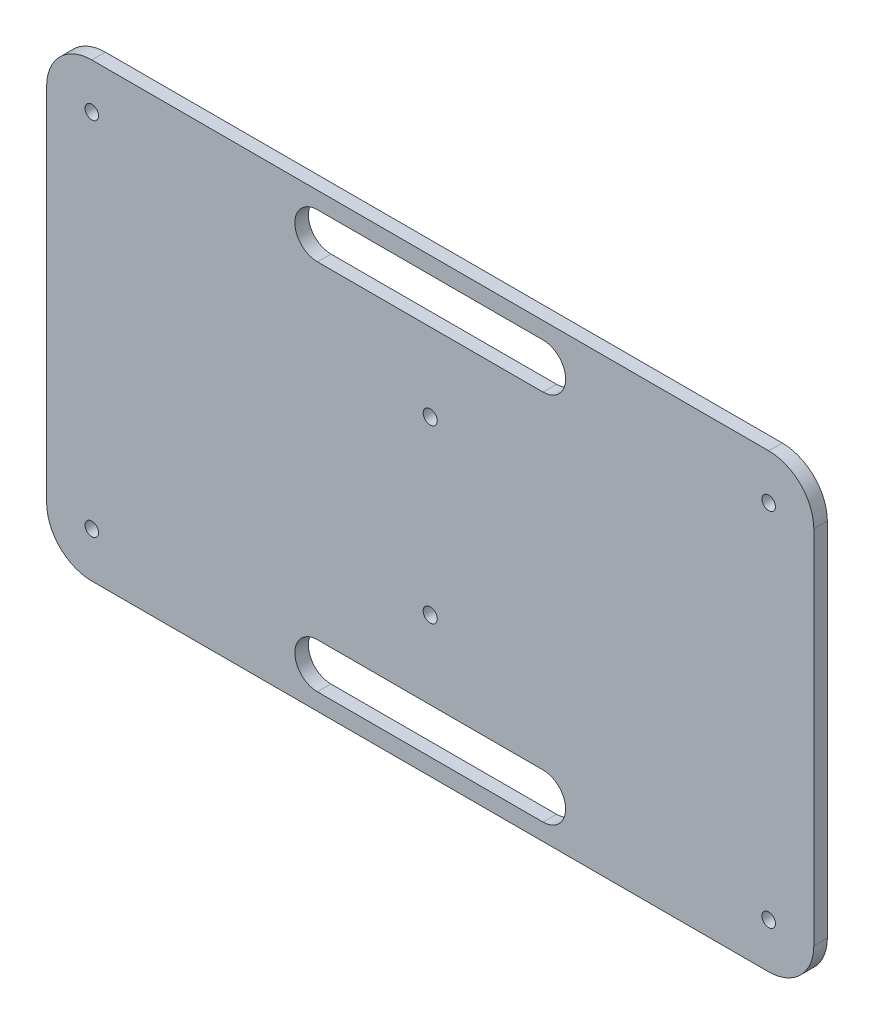
from build123d import *

# Parameters (mm, degrees)
SKETCH1_R           = 1.5
SKETCH1_R_2         = 1.56
BOSS_EXTRUDE1_DEPTH = 3


with BuildPart() as part:
    # Sketch1 → Boss-Extrude1 (new body)
    with BuildSketch(Plane.XY):
        with BuildLine():
            Line((-75, 50), (75, 50))
            ThreePointArc((75, 50), (82.071067812, 47.071067812), (85, 40))
            Line((85, 40), (85, -40))
            ThreePointArc((85, -40), (82.071067812, -47.071067812), (75, -50))
            Line((75, -50), (-75, -50))
            ThreePointArc((-75, -50), (-82.071067812, -47.071067812), (-85, -40))
            Line((-85, -40), (-85, 40))
            ThreePointArc((-85, 40), (-82.071067812, 47.071067812), (-75, 50))
        make_face()
        with Locations((-75, 40)):
            Circle(SKETCH1_R, mode=Mode.SUBTRACT)
        with Locations((75, 40)):
            Circle(SKETCH1_R, mode=Mode.SUBTRACT)
        with Locations((75, -40)):
            Circle(SKETCH1_R, mode=Mode.SUBTRACT)
        with Locations((-75, -40)):
            Circle(SKETCH1_R, mode=Mode.SUBTRACT)
        with Locations((0, 19)):
            Circle(SKETCH1_R_2, mode=Mode.SUBTRACT)
        with Locations((0, -19)):
            Circle(SKETCH1_R_2, mode=Mode.SUBTRACT)
        with BuildLine():
            Line((-25, 46.257829906), (25, 46.257829906))
            ThreePointArc((25, 46.257829906), (30, 41.257829906), (25, 36.257829906))
            Line((25, 36.257829906), (-25, 36.257829906))
            ThreePointArc((-25, 36.257829906), (-30, 41.257829906), (-25, 46.257829906))
        make_face(mode=Mode.SUBTRACT)
        with BuildLine():
            Line((-25, -46.257829906), (25, -46.257829906))
            ThreePointArc((25, -46.257829906), (30, -41.257829906), (25, -36.257829906))
            Line((25, -36.257829906), (-25, -36.257829906))
            ThreePointArc((-25, -36.257829906), (-30, -41.257829906), (-25, -46.257829906))
        make_face(mode=Mode.SUBTRACT)
    extrude(amount=BOSS_EXTRUDE1_DEPTH)


solid = part.part
